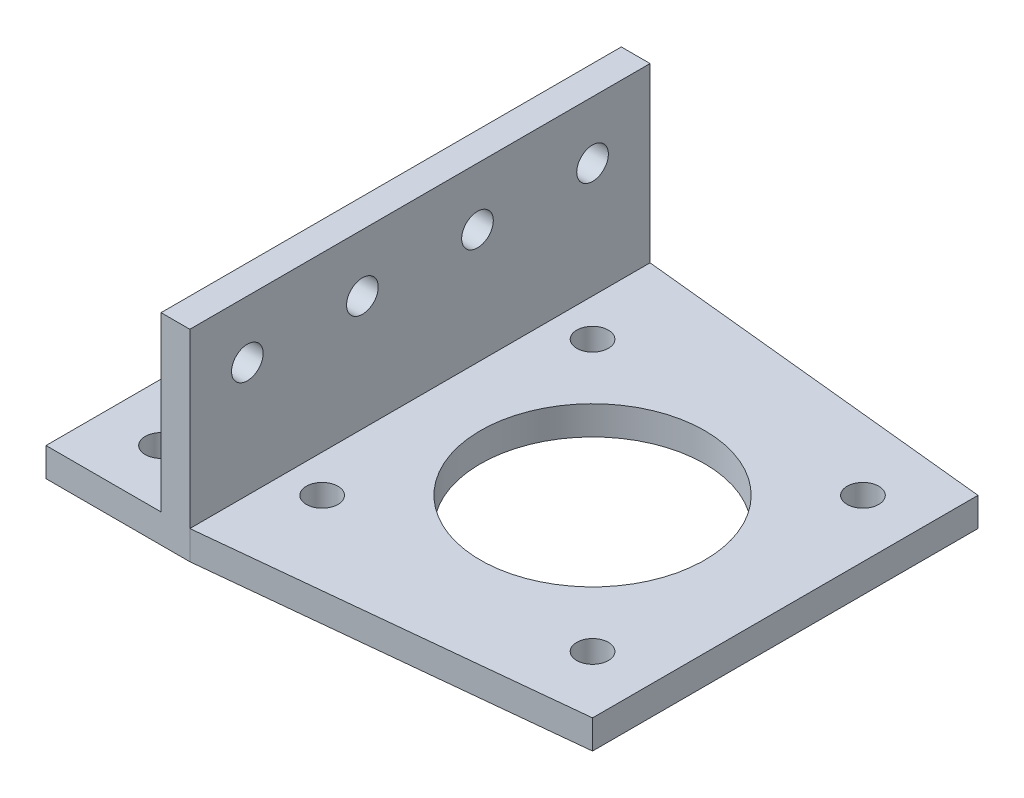
from build123d import *

# Parameters (mm, degrees)
BOSS_EXTRU_1_DEPTH      = 80
ENL_V_MAT_EXTRU_1_REACH = 91.582
ESQUISSE2_R             = 2.75
ENL_V_MAT_EXTRU_2_REACH = 92.436
ESQUISSE3_R             = 2.75
ESQUISSE5_R             = 2.75
ESQUISSE5_R_2           = 19.5
BOSS_EXTRU_2_DEPTH      = 5


with BuildPart() as part:
    # Esquisse1 → Boss.-Extru.1 (new body)
    with BuildSketch(Plane.XY):
        Polygon((-4.641855204, 0), (-4.641855204, 35), (-9.641855204, 35), (-9.641855204, 5), (-29.641855204, 5), (-29.641855204, 0), align=None)
    extrude(amount=BOSS_EXTRU_1_DEPTH)

    # Esquisse2 → Enlèv. mat.-Extru.1 (cut, up to next)
    with BuildSketch(Plane.ZY.offset(9.641855204), mode=Mode.PRIVATE) as enl_v_mat_extru_1_sk1:
        with Locations(Location((10, 25, 0), (0, 0, 270))):
            Circle(ESQUISSE2_R)
    enl_v_mat_extru_1_tool1 = extrude(enl_v_mat_extru_1_sk1.sketch, amount=-ENL_V_MAT_EXTRU_1_REACH, mode=Mode.PRIVATE) & part.part
    # Esquisse2 → Enlèv. mat.-Extru.1 (cut, up to next)
    with BuildSketch(Plane.ZY.offset(9.641855204), mode=Mode.PRIVATE) as enl_v_mat_extru_1_sk2:
        with Locations(Location((50, 25, 0), (0, 0, 270))):
            Circle(ESQUISSE2_R)
    enl_v_mat_extru_1_tool2 = extrude(enl_v_mat_extru_1_sk2.sketch, amount=-ENL_V_MAT_EXTRU_1_REACH, mode=Mode.PRIVATE) & part.part
    # Esquisse2 → Enlèv. mat.-Extru.1 (cut, up to next)
    with BuildSketch(Plane.ZY.offset(9.641855204), mode=Mode.PRIVATE) as enl_v_mat_extru_1_sk3:
        with Locations(Location((70, 25, 0), (0, 0, 270))):
            Circle(ESQUISSE2_R)
    enl_v_mat_extru_1_tool3 = extrude(enl_v_mat_extru_1_sk3.sketch, amount=-ENL_V_MAT_EXTRU_1_REACH, mode=Mode.PRIVATE) & part.part
    # Esquisse2 → Enlèv. mat.-Extru.1 (cut, up to next)
    with BuildSketch(Plane.ZY.offset(9.641855204), mode=Mode.PRIVATE) as enl_v_mat_extru_1_sk4:
        with Locations(Location((30, 25, 0), (0, 0, 270))):
            Circle(ESQUISSE2_R)
    enl_v_mat_extru_1_tool4 = extrude(enl_v_mat_extru_1_sk4.sketch, amount=-ENL_V_MAT_EXTRU_1_REACH, mode=Mode.PRIVATE) & part.part
    add(enl_v_mat_extru_1_tool1.solids().sort_by_distance((-9.641855, 25, 10))[0], mode=Mode.SUBTRACT)
    add(enl_v_mat_extru_1_tool2.solids().sort_by_distance((-9.641855, 25, 50))[0], mode=Mode.SUBTRACT)
    add(enl_v_mat_extru_1_tool3.solids().sort_by_distance((-9.641855, 25, 70))[0], mode=Mode.SUBTRACT)
    add(enl_v_mat_extru_1_tool4.solids().sort_by_distance((-9.641855, 25, 30))[0], mode=Mode.SUBTRACT)

    # Esquisse3 → Enlèv. mat.-Extru.2 (cut, up to next)
    with BuildSketch(Plane(origin=(0, 5, 0), x_dir=(1, 0, 0), z_dir=(0, 1, 0)), mode=Mode.PRIVATE) as enl_v_mat_extru_2_sk1:
        with Locations(Location((-19.641855204, -10, 0), (0, 0, 180))):
            Circle(ESQUISSE3_R)
    enl_v_mat_extru_2_tool1 = extrude(enl_v_mat_extru_2_sk1.sketch, amount=-ENL_V_MAT_EXTRU_2_REACH, mode=Mode.PRIVATE) & part.part
    # Esquisse3 → Enlèv. mat.-Extru.2 (cut, up to next)
    with BuildSketch(Plane(origin=(0, 5, 0), x_dir=(1, 0, 0), z_dir=(0, 1, 0)), mode=Mode.PRIVATE) as enl_v_mat_extru_2_sk2:
        with Locations(Location((-19.641855204, -30, 0), (0, 0, 180))):
            Circle(ESQUISSE3_R)
    enl_v_mat_extru_2_tool2 = extrude(enl_v_mat_extru_2_sk2.sketch, amount=-ENL_V_MAT_EXTRU_2_REACH, mode=Mode.PRIVATE) & part.part
    # Esquisse3 → Enlèv. mat.-Extru.2 (cut, up to next)
    with BuildSketch(Plane(origin=(0, 5, 0), x_dir=(1, 0, 0), z_dir=(0, 1, 0)), mode=Mode.PRIVATE) as enl_v_mat_extru_2_sk3:
        with Locations(Location((-19.641855204, -50, 0), (0, 0, 180))):
            Circle(ESQUISSE3_R)
    enl_v_mat_extru_2_tool3 = extrude(enl_v_mat_extru_2_sk3.sketch, amount=-ENL_V_MAT_EXTRU_2_REACH, mode=Mode.PRIVATE) & part.part
    # Esquisse3 → Enlèv. mat.-Extru.2 (cut, up to next)
    with BuildSketch(Plane(origin=(0, 5, 0), x_dir=(1, 0, 0), z_dir=(0, 1, 0)), mode=Mode.PRIVATE) as enl_v_mat_extru_2_sk4:
        with Locations(Location((-19.641855204, -70, 0), (0, 0, 180))):
            Circle(ESQUISSE3_R)
    enl_v_mat_extru_2_tool4 = extrude(enl_v_mat_extru_2_sk4.sketch, amount=-ENL_V_MAT_EXTRU_2_REACH, mode=Mode.PRIVATE) & part.part
    add(enl_v_mat_extru_2_tool1.solids().sort_by_distance((-19.641855, 5, 10))[0], mode=Mode.SUBTRACT)
    add(enl_v_mat_extru_2_tool2.solids().sort_by_distance((-19.641855, 5, 30))[0], mode=Mode.SUBTRACT)
    add(enl_v_mat_extru_2_tool3.solids().sort_by_distance((-19.641855, 5, 50))[0], mode=Mode.SUBTRACT)
    add(enl_v_mat_extru_2_tool4.solids().sort_by_distance((-19.641855, 5, 70))[0], mode=Mode.SUBTRACT)

    # Esquisse5 → Boss.-Extru.2 (add)
    with BuildSketch(Plane.XZ):
        Polygon((-4.641855204, 0), (58.858144796, 6.5), (58.858144796, 73.5), (-4.641855204, 80), align=None)
        with Locations(Location((1.858144796, 16.5, 0), (0, 0, 270))):
            Circle(ESQUISSE5_R, mode=Mode.SUBTRACT)
        with Locations(Location((1.858144796, 63.5, 0), (0, 0, 270))):
            Circle(ESQUISSE5_R, mode=Mode.SUBTRACT)
        with Locations(Location((48.858144796, 63.5, 0), (0, 0, 270))):
            Circle(ESQUISSE5_R, mode=Mode.SUBTRACT)
        with Locations(Location((48.858144796, 16.5, 0), (0, 0, 270))):
            Circle(ESQUISSE5_R, mode=Mode.SUBTRACT)
        with Locations(Location((25.358144796, 40, 0), (0, 0, 270))):
            Circle(ESQUISSE5_R_2, mode=Mode.SUBTRACT)
    extrude(amount=-BOSS_EXTRU_2_DEPTH)


solid = part.part
